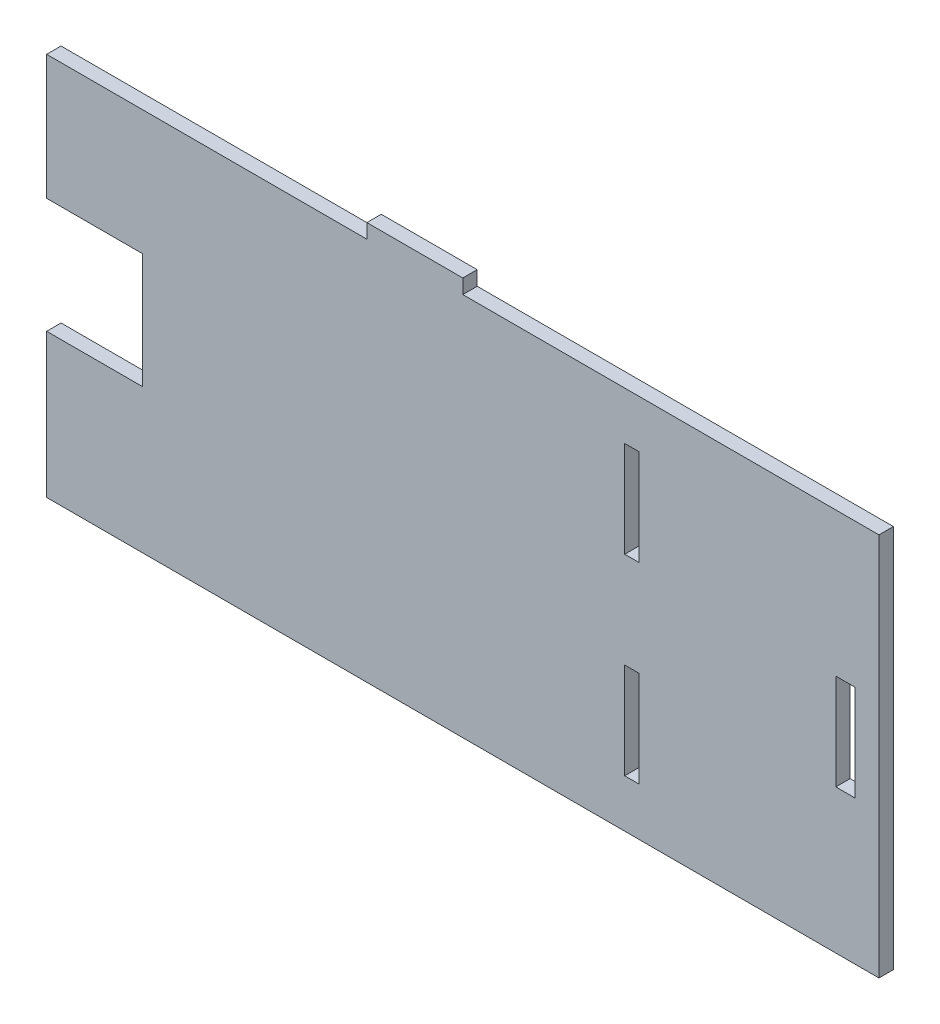
from build123d import *

# Parameters (mm, degrees)
ESQUISSE2_W             = 173.5
ESQUISSE2_H             = 80
BOSS_EXTRU_2_DEPTH      = 3
ENL_V_MAT_EXTRU_1_REACH = 193.079
ESQUISSE3_W             = 3
ESQUISSE3_H             = 20
ESQUISSE4_W             = 20
ESQUISSE4_H             = 3
BOSS_EXTRU_3_DEPTH      = 3
ESQUISSE5_W             = 4
ESQUISSE5_H             = 20
ENL_V_MAT_EXTRU_2_DEPTH = 10
ESQUISSE6_W             = 20
ESQUISSE6_H             = 24
ENL_V_MAT_EXTRU_3_DEPTH = 10


with BuildPart() as part:
    # Esquisse2 → Boss.-Extru.2 (new body)
    with BuildSketch(Plane.XY):
        with Locations((-86.75, -40)):
            Rectangle(ESQUISSE2_W, ESQUISSE2_H)
    extrude(amount=BOSS_EXTRU_2_DEPTH)

    # Esquisse3 → Enlèv. mat.-Extru.1 (cut, up to next)
    with BuildSketch(Plane.XY.offset(3), mode=Mode.PRIVATE) as enl_v_mat_extru_1_sk1:
        with Locations((-51.5, -60)):
            Rectangle(ESQUISSE3_W, ESQUISSE3_H)
    enl_v_mat_extru_1_tool1 = extrude(enl_v_mat_extru_1_sk1.sketch, amount=-ENL_V_MAT_EXTRU_1_REACH, mode=Mode.PRIVATE) & part.part
    # Esquisse3 → Enlèv. mat.-Extru.1 (cut, up to next)
    with BuildSketch(Plane.XY.offset(3), mode=Mode.PRIVATE) as enl_v_mat_extru_1_sk2:
        with Locations((-51.5, -20)):
            Rectangle(ESQUISSE3_W, ESQUISSE3_H)
    enl_v_mat_extru_1_tool2 = extrude(enl_v_mat_extru_1_sk2.sketch, amount=-ENL_V_MAT_EXTRU_1_REACH, mode=Mode.PRIVATE) & part.part
    add(enl_v_mat_extru_1_tool1.solids().sort_by_distance((-51.5, -60, 3))[0], mode=Mode.SUBTRACT)
    add(enl_v_mat_extru_1_tool2.solids().sort_by_distance((-51.5, -20, 3))[0], mode=Mode.SUBTRACT)

    # Esquisse4 → Boss.-Extru.3 (add)
    with BuildSketch(Plane(origin=(0, 0, 0), x_dir=(1, 0, 0), z_dir=(0, 1, 0))):
        with Locations((-96.75, -1.5)):
            Rectangle(ESQUISSE4_W, ESQUISSE4_H)
    extrude(amount=BOSS_EXTRU_3_DEPTH)

    # Esquisse5 → Enlèv. mat.-Extru.2 (cut)
    with BuildSketch(Plane(origin=(0, 0, 0), x_dir=(-1, 0, 0), z_dir=(0, 0, -1))):
        with Locations((7, -40)):
            Rectangle(ESQUISSE5_W, ESQUISSE5_H)
    extrude(amount=-ENL_V_MAT_EXTRU_2_DEPTH, mode=Mode.SUBTRACT)

    # Esquisse6 → Enlèv. mat.-Extru.3 (cut)
    with BuildSketch(Plane.XY.offset(3)):
        with Locations((-163.5, -38)):
            Rectangle(ESQUISSE6_W, ESQUISSE6_H)
    extrude(amount=-ENL_V_MAT_EXTRU_3_DEPTH, mode=Mode.SUBTRACT)


solid = part.part
